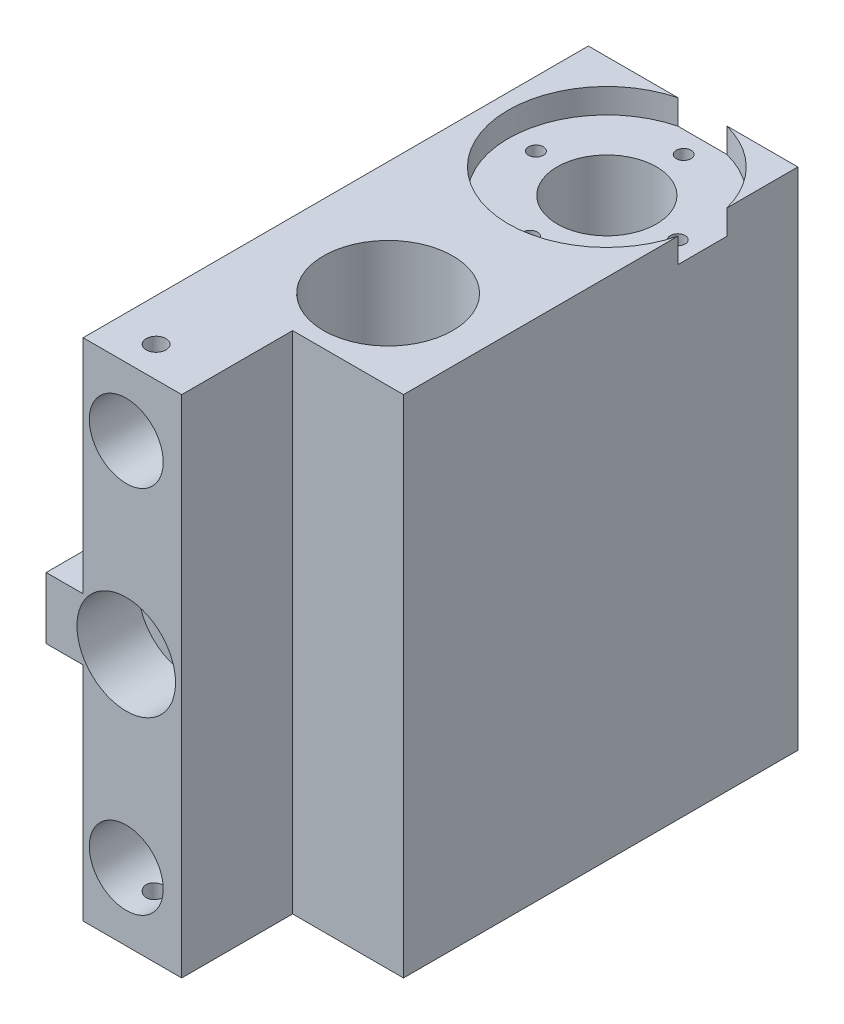
from build123d import *
from build123d.topology import SkipClean

# Parameters (mm, degrees)
SKETCH1_W           = 40
SKETCH1_H           = 82
SKETCH1_R           = 5.5
SKETCH1_R_2         = 6
BOSS_EXTRUDE1_DEPTH = 12
BOSS_EXTRUDE2_START = 70
SKETCH2_W           = 40
SKETCH2_H           = 82
SKETCH2_R           = 5.5
BOSS_EXTRUDE2_DEPTH = 70
SKETCH3_R           = 1.6
CUT_EXTRUDE1_DEPTH  = 10
CUT_EXTRUDE2_START  = -10
SKETCH4_R           = 1.6
CUT_EXTRUDE2_DEPTH  = 10
SKETCH5_R           = 10.5
SKETCH5_R_2         = 5.5
CUT_EXTRUDE3_DEPTH  = 100
SKETCH6_R           = 16
CUT_EXTRUDE4_DEPTH  = 4
SKETCH19_R          = 8.05
CUT_EXTRUDE17_DEPTH = 16
SKETCH12_R          = 1.2
CUT_EXTRUDE12_DEPTH = 12
SKETCH13_W          = 20
SKETCH13_H          = 70
BOSS_EXTRUDE3_DEPTH = 30
SKETCH14_R          = 2
CUT_EXTRUDE13_DEPTH = 12
CUT_EXTRUDE14_DEPTH = 115
SKETCH18_R          = 19.1
CUT_EXTRUDE16_DEPTH = 2
SKETCH20_W          = 18
SKETCH20_H          = 18
CUT_EXTRUDE18_DEPTH = 100
SKETCH21_R          = 8
CUT_EXTRUDE19_DEPTH = 10


with BuildPart() as part:
    # Sketch1 → Boss-Extrude1 (new body)
    with BuildSketch(Plane.XY):
        with Locations((-20, -41)):
            Rectangle(SKETCH1_W, SKETCH1_H)
        with Locations((-27, -41)):
            Circle(SKETCH1_R, mode=Mode.SUBTRACT)
        with Locations((-27, -11)):
            Circle(SKETCH1_R_2, mode=Mode.SUBTRACT)
        with Locations((-27, -71)):
            Circle(SKETCH1_R_2, mode=Mode.SUBTRACT)
    extrude(amount=BOSS_EXTRUDE1_DEPTH)

    # Sketch2 → Boss-Extrude2 (add)
    with SkipClean():  # the faces are left unmerged after this step: merging them gives an invalid solid
        with BuildSketch(Plane(origin=(0, 0, 0), x_dir=(-1, 0, 0), z_dir=(0, 0, -1)).offset(BOSS_EXTRUDE2_START)):
            with Locations((20, -41)):
                Rectangle(SKETCH2_W, SKETCH2_H)
            with Locations((27, -41)):
                Circle(SKETCH2_R, mode=Mode.SUBTRACT)
        extrude(amount=-BOSS_EXTRUDE2_DEPTH)

    # Sketch3 → Cut-Extrude1 (cut)
    with SkipClean():  # the faces are left unmerged after this step: merging them gives an invalid solid
        with BuildSketch(Plane(origin=(0, 0, 0), x_dir=(1, 0, 0), z_dir=(0, 1, 0))):
            with Locations(Location((-27.154767421, -7, 0), (0, 0, 270))):
                Circle(SKETCH3_R)
        extrude(amount=-CUT_EXTRUDE1_DEPTH, mode=Mode.SUBTRACT)

    # Sketch4 → Cut-Extrude2 (cut)
    with SkipClean():  # the faces are left unmerged after this step: merging them gives an invalid solid
        with BuildSketch(Plane.XZ.offset(82).offset(CUT_EXTRUDE2_START)):
            with Locations(Location((-27.154767421, 7, 0), (0, 0, 90))):
                Circle(SKETCH4_R)
        extrude(amount=CUT_EXTRUDE2_DEPTH, mode=Mode.SUBTRACT)

    # Sketch5 → Cut-Extrude3 (cut)
    with SkipClean():  # the faces are left unmerged after this step: merging them gives an invalid solid
        with BuildSketch(Plane(origin=(0, 0, 0), x_dir=(1, 0, 0), z_dir=(0, 1, 0))):
            with Locations(Location((-15.5, 19, 0), (0, 0, 270))):
                Circle(SKETCH5_R)
            with Locations(Location((-15.5, 54.5, 0), (0, 0, 270))):
                Circle(SKETCH5_R_2)
        extrude(amount=-CUT_EXTRUDE3_DEPTH, mode=Mode.SUBTRACT)

    # Sketch6 → Cut-Extrude4 (cut)
    with SkipClean():  # the faces are left unmerged after this step: merging them gives an invalid solid
        with BuildSketch(Plane(origin=(0, 0, 0), x_dir=(1, 0, 0), z_dir=(0, 1, 0))):
            with Locations((-15.5, 54.5)):
                Circle(SKETCH6_R)
        extrude(amount=-CUT_EXTRUDE4_DEPTH, mode=Mode.SUBTRACT)

    # Sketch19 → Cut-Extrude17 (cut)
    with SkipClean():  # the faces are left unmerged after this step: merging them gives an invalid solid
        with BuildSketch(Plane(origin=(0, -4, 0), x_dir=(1, 0, 0), z_dir=(0, 1, 0))):
            with Locations(Location((-15.5, 54.5, 0), (0, 0, 180))):
                Circle(SKETCH19_R)
        extrude(amount=-CUT_EXTRUDE17_DEPTH, mode=Mode.SUBTRACT)

    # Sketch12 → Cut-Extrude12 (cut)
    with SkipClean():  # the faces are left unmerged after this step: merging them gives an invalid solid
        with BuildSketch(Plane(origin=(0, -4, 0), x_dir=(1, 0, 0), z_dir=(0, 1, 0))):
            with Locations(Location((-15.98192958, 42.509681244, 0), (0, 0, 180))):
                Circle(SKETCH12_R)
            with Locations(Location((-3.509681244, 54.01807042, 0), (0, 0, 180))):
                Circle(SKETCH12_R)
            with Locations(Location((-15.01807042, 66.490318756, 0), (0, 0, 180))):
                Circle(SKETCH12_R)
            with Locations(Location((-27.490318756, 54.98192958, 0), (0, 0, 180))):
                Circle(SKETCH12_R)
        extrude(amount=-CUT_EXTRUDE12_DEPTH, mode=Mode.SUBTRACT)

    # Sketch13 → Boss-Extrude3 (add)
    with SkipClean():  # the faces are left unmerged after this step: merging them gives an invalid solid
        with BuildSketch(Plane(origin=(0, 0, -70), x_dir=(-1, 0, 0), z_dir=(0, 0, -1))):
            with Locations((50, -35)):
                Rectangle(SKETCH13_W, SKETCH13_H)
        extrude(amount=-BOSS_EXTRUDE3_DEPTH)

    # Sketch14 → Cut-Extrude13 (cut)
    with SkipClean():  # the faces are left unmerged after this step: merging them gives an invalid solid
        with BuildSketch(Plane(origin=(0, 0, -70), x_dir=(-1, 0, 0), z_dir=(0, 0, -1))):
            with Locations((50.54, -41)):
                Circle(SKETCH14_R)
            with Locations((27, -17.46)):
                Circle(SKETCH14_R)
            with Locations((3.46, -41)):
                Circle(SKETCH14_R)
            with Locations((27, -64.54)):
                Circle(SKETCH14_R)
        extrude(amount=-CUT_EXTRUDE13_DEPTH, mode=Mode.SUBTRACT)

    # Sketch15 → Cut-Extrude14 (cut)
    with SkipClean():  # the faces are left unmerged after this step: merging them gives an invalid solid
        with BuildSketch(Plane(origin=(0, 0, -70), x_dir=(-1, 0, 0), z_dir=(0, 0, -1))):
            Polygon((34, 0), (34, -36), (54.581085422, -36), (54.581085422, -46), (34, -46), (34, -82), (77.520554958, -82), (77.520554958, 0), align=None)
        extrude(amount=-CUT_EXTRUDE14_DEPTH, mode=Mode.SUBTRACT)

    # Sketch18 → Cut-Extrude16 (cut)
    with SkipClean():  # the faces are left unmerged after this step: merging them gives an invalid solid
        with BuildSketch(Plane(origin=(0, 0, -70), x_dir=(-1, 0, 0), z_dir=(0, 0, -1))):
            with Locations((27, -41)):
                Circle(SKETCH18_R)
        extrude(amount=-CUT_EXTRUDE16_DEPTH, mode=Mode.SUBTRACT)

    # Sketch20 → Cut-Extrude18 (cut)
    with SkipClean():  # the faces are left unmerged after this step: merging them gives an invalid solid
        with BuildSketch(Plane.XZ.offset(82)):
            with Locations((-9, 3)):
                Rectangle(SKETCH20_W, SKETCH20_H)
        extrude(amount=-CUT_EXTRUDE18_DEPTH, mode=Mode.SUBTRACT)

    # Sketch21 → Cut-Extrude19 (cut)
    with BuildSketch(Plane.XY.offset(12)):
        with Locations((-27, -41)):
            Circle(SKETCH21_R)
    extrude(amount=-CUT_EXTRUDE19_DEPTH, mode=Mode.SUBTRACT)


solid = part.part
